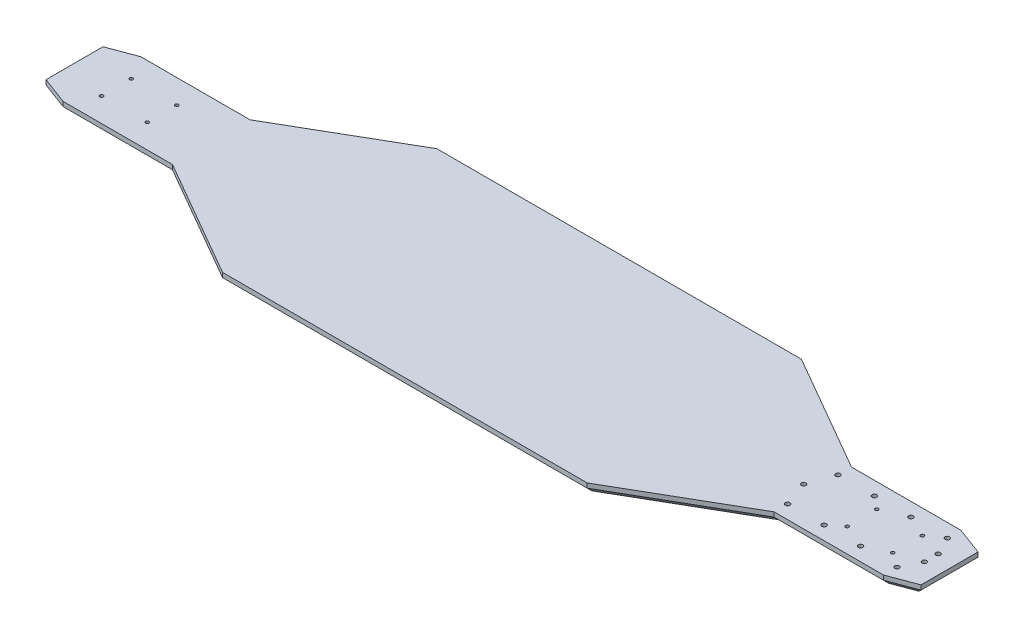
from build123d import *

# Parameters (mm, degrees)
BOSS_EXTRUDE1_DEPTH = 15.24
SKETCH2_R           = 2.38125
CUT_EXTRUDE1_DEPTH  = 15.24
CHAMFER1_SIZE       = 8.89
SKETCH3_R           = 3.175
CUT_EXTRUDE2_DEPTH  = 7.9375
SKETCH4_R           = 3.175
CUT_EXTRUDE3_DEPTH  = 7.9375


with BuildPart() as part:
    # Sketch1 → Boss-Extrude1 (new body)
    with BuildSketch(Plane(origin=(0, 0, 0), x_dir=(1, 0, 0), z_dir=(0, 1, 0))):
        Polygon((-241.141854356, 15.046517442), (-241.141854356, 94.421517442), (-203.041854356, 108.709017442), (-50.641854356, 108.709017442), (114.335985065, 203.959017442), (368.335985065, 203.959017442), (622.335985065, 203.959017442), (787.313824486, 108.709017442), (939.713824486, 108.709017442), (977.813824486, 94.421517442), (977.813824486, 15.046517442), (939.713824486, 0.759017442), (787.313824486, 0.759017442), (622.335985065, -94.490982558), (368.335985065, -94.490982558), (114.335985065, -94.490982558), (-50.641854356, 0.759017442), (-203.041854356, 0.759017442), align=None)
    extrude(amount=BOSS_EXTRUDE1_DEPTH)

    # Sketch2 → Cut-Extrude1 (cut)
    with BuildSketch(Plane(origin=(0, 0, 0), x_dir=(-1, 0, 0), z_dir=(0, -1, 0))):
        with Locations(Location((182.721854356, 34.096517442, 0), (0, 0, 90))):
            Circle(SKETCH2_R)
        with Locations(Location((182.721854356, 75.371517443, 0), (0, 0, 90))):
            Circle(SKETCH2_R)
        with Locations(Location((119.221854356, 75.371517443, 0), (0, 0, 90))):
            Circle(SKETCH2_R)
        with Locations(Location((119.221854356, 34.096517443, 0), (0, 0, 90))):
            Circle(SKETCH2_R)
        with Locations(Location((-855.893824486, 75.371517443, 0), (0, 0, 90))):
            Circle(SKETCH2_R)
        with Locations(Location((-919.393824486, 75.371517443, 0), (0, 0, 90))):
            Circle(SKETCH2_R)
        with Locations(Location((-919.393824486, 34.096517442, 0), (0, 0, 90))):
            Circle(SKETCH2_R)
        with Locations(Location((-855.893824486, 34.096517443, 0), (0, 0, 90))):
            Circle(SKETCH2_R)
    extrude(amount=-CUT_EXTRUDE1_DEPTH, mode=Mode.SUBTRACT)

    # Chamfer1
    chamfer1_edges = [part.edges().sort_by_distance(p)[0] for p in [
        (-126.841854356, 0, -0.759017442),
        (-222.091854356, 0, -7.902767442),
        (-241.141854356, 0, -54.734017442),
        (-222.091854356, 0, -101.565267442),
        (-126.841854356, 0, -108.709017442),
        (31.847065354, 0, -156.334017442),
        (368.335985065, 0, -203.959017442),
        (704.824904775, 0, -156.334017442),
        (863.513824486, 0, -108.709017442),
        (958.763824486, 0, -101.565267442),
        (977.813824486, 0, -54.734017442),
        (958.763824486, 0, -7.902767442),
        (863.513824486, 0, -0.759017442),
        (704.824904775, 0, 46.865982558),
        (368.335985065, 0, 94.490982558),
        (31.847065354, 0, 46.865982558),
    ]]
    chamfer(chamfer1_edges, length=CHAMFER1_SIZE)

    # Sketch3 → Cut-Extrude2 (cut)
    with BuildSketch(Plane.XZ):
        with Locations(Location((955.588824486, -80.134017442, 0), (0, 0, 270))):
            Circle(SKETCH3_R)
        with Locations(Location((955.588824486, -29.334017442, 0), (0, 0, 270))):
            Circle(SKETCH3_R)
        with Locations(Location((546.135985065, -156.334017442, 0), (0, 0, 270))):
            Circle(SKETCH3_R)
        with Locations(Location((482.635985065, -156.334017442, 0), (0, 0, 270))):
            Circle(SKETCH3_R)
        with Locations(Location((546.135985065, -105.534017442, 0), (0, 0, 270))):
            Circle(SKETCH3_R)
        with Locations(Location((482.635985065, -105.534017442, 0), (0, 0, 270))):
            Circle(SKETCH3_R)
        with Locations(Location((546.135985065, -80.134017442, 0), (0, 0, 270))):
            Circle(SKETCH3_R)
        with Locations(Location((546.135985065, -29.334017442, 0), (0, 0, 270))):
            Circle(SKETCH3_R)
        with Locations(Location((482.635985065, -29.334017442, 0), (0, 0, 270))):
            Circle(SKETCH3_R)
        with Locations(Location((482.635985065, -80.134017442, 0), (0, 0, 270))):
            Circle(SKETCH3_R)
        with Locations(Location((546.135985065, -3.934017442, 0), (0, 0, 270))):
            Circle(SKETCH3_R)
        with Locations(Location((546.135985065, 46.865982558, 0), (0, 0, 270))):
            Circle(SKETCH3_R)
        with Locations(Location((482.635985065, 46.865982558, 0), (0, 0, 270))):
            Circle(SKETCH3_R)
        with Locations(Location((482.635985065, -3.934017442, 0), (0, 0, 270))):
            Circle(SKETCH3_R)
        with Locations(Location((730.285985065, -54.734017442, 0), (0, 0, 270))):
            Circle(SKETCH3_R)
        with Locations(Location((730.285985065, -105.534017442, 0), (0, 0, 270))):
            Circle(SKETCH3_R)
        with Locations(Location((730.285985065, -3.934017442, 0), (0, 0, 270))):
            Circle(SKETCH3_R)
        with Locations(Location((711.235985065, 8.765982558, 0), (0, 0, 270))):
            Circle(SKETCH3_R)
        with Locations(Location((660.435985065, 8.765982558, 0), (0, 0, 270))):
            Circle(SKETCH3_R)
        with Locations(Location((622.335985065, -156.334017442, 0), (0, 0, 270))):
            Circle(SKETCH3_R)
        with Locations(Location((404.848485065, -156.334017442, 0), (0, 0, 270))):
            Circle(SKETCH3_R)
        with Locations(Location((404.848485065, -105.534017442, 0), (0, 0, 270))):
            Circle(SKETCH3_R)
        with Locations(Location((404.848485065, -54.734017442, 0), (0, 0, 270))):
            Circle(SKETCH3_R)
        with Locations(Location((404.848485065, -3.934017442, 0), (0, 0, 270))):
            Circle(SKETCH3_R)
        with Locations(Location((404.848485065, 46.865982558, 0), (0, 0, 270))):
            Circle(SKETCH3_R)
        with Locations(Location((660.435985065, -118.234017442, 0), (0, 0, 90))):
            Circle(SKETCH3_R)
        with Locations(Location((711.235985065, -118.234017442, 0), (0, 0, 90))):
            Circle(SKETCH3_R)
        with Locations(Location((641.385985065, -105.534017442, 0), (0, 0, 90))):
            Circle(SKETCH3_R)
        with Locations(Location((641.385985065, -54.734017442, 0), (0, 0, 90))):
            Circle(SKETCH3_R)
        with Locations(Location((641.385985065, -3.934017442, 0), (0, 0, 270))):
            Circle(SKETCH3_R)
        with Locations(Location((622.335985065, -105.534017442, 0), (0, 0, 270))):
            Circle(SKETCH3_R)
        with Locations(Location((622.335985065, -54.734017442, 0), (0, 0, 270))):
            Circle(SKETCH3_R)
        with Locations(Location((622.335985065, -3.934017442, 0), (0, 0, 270))):
            Circle(SKETCH3_R)
        with Locations(Location((622.335985065, 46.865982558, 0), (0, 0, 270))):
            Circle(SKETCH3_R)
        with Locations(Location((601.698485065, -181.734017442, 0), (0, 0, 270))):
            Circle(SKETCH3_R)
        with Locations(Location((550.898485065, -181.734017442, 0), (0, 0, 270))):
            Circle(SKETCH3_R)
        with Locations(Location((500.098485065, -181.734017443, 0), (0, 0, 270))):
            Circle(SKETCH3_R)
        with Locations(Location((449.298485065, -181.734017443, 0), (0, 0, 270))):
            Circle(SKETCH3_R)
        with Locations(Location((398.498485065, -181.734017443, 0), (0, 0, 270))):
            Circle(SKETCH3_R)
        with Locations(Location((398.498485065, 72.265982558, 0), (0, 0, 90))):
            Circle(SKETCH3_R)
        with Locations(Location((449.298485065, 72.265982558, 0), (0, 0, 90))):
            Circle(SKETCH3_R)
        with Locations(Location((500.098485065, 72.265982558, 0), (0, 0, 90))):
            Circle(SKETCH3_R)
        with Locations(Location((550.898485065, 72.265982558, 0), (0, 0, 90))):
            Circle(SKETCH3_R)
        with Locations(Location((601.698485065, 72.265982558, 0), (0, 0, 90))):
            Circle(SKETCH3_R)
        with Locations(Location((377.860985065, -156.334017442, 0), (0, 0, 90))):
            Circle(SKETCH3_R)
        with Locations(Location((377.860985065, -105.534017442, 0), (0, 0, 90))):
            Circle(SKETCH3_R)
        with Locations(Location((377.860985065, -54.734017442, 0), (0, 0, 90))):
            Circle(SKETCH3_R)
        with Locations(Location((377.860985065, -3.934017442, 0), (0, 0, 90))):
            Circle(SKETCH3_R)
        with Locations(Location((377.860985065, 46.865982558, 0), (0, 0, 90))):
            Circle(SKETCH3_R)
        with Locations(Location((936.538824486, -29.334017442, 0), (0, 0, 270))):
            Circle(SKETCH3_R)
        with Locations(Location((936.538824486, -80.134017442, 0), (0, 0, 270))):
            Circle(SKETCH3_R)
    extrude(amount=-CUT_EXTRUDE2_DEPTH, mode=Mode.SUBTRACT)

    # Sketch4 → Cut-Extrude3 (cut)
    with BuildSketch(Plane(origin=(0, 15.24, 0), x_dir=(1, 0, 0), z_dir=(0, 1, 0))):
        with Locations(Location((939.713824486, 89.761899088, 0), (0, 0, 270.000000003))):
            Circle(SKETCH4_R)
        with Locations(Location((939.713824486, 19.706135797, 0), (0, 0, 90))):
            Circle(SKETCH4_R)
        with Locations(Location((888.913824486, 89.761899088, 0), (0, 0, 270.000000002))):
            Circle(SKETCH4_R)
        with Locations(Location((888.913824486, 19.706135797, 0), (0, 0, 90))):
            Circle(SKETCH4_R)
        with Locations(Location((838.113824486, 89.761899088, 0), (0, 0, 270.000000002))):
            Circle(SKETCH4_R)
        with Locations(Location((838.113824486, 19.706135797, 0), (0, 0, 90))):
            Circle(SKETCH4_R)
        with Locations(Location((787.313824486, 89.761899088, 0), (0, 0, 270.000000002))):
            Circle(SKETCH4_R)
        with Locations(Location((787.313824486, 19.706135797, 0), (0, 0, 90))):
            Circle(SKETCH4_R)
        with Locations(Location((774.613824486, 54.734017442, 0), (0, 0, 270))):
            Circle(SKETCH4_R)
        with Locations(Location((952.413824486, 45.209017442, 0), (0, 0, 90))):
            Circle(SKETCH4_R)
        with Locations(Location((952.413824486, 64.259017442, 0), (0, 0, 270))):
            Circle(SKETCH4_R)
    extrude(amount=-CUT_EXTRUDE3_DEPTH, mode=Mode.SUBTRACT)


solid = part.part
